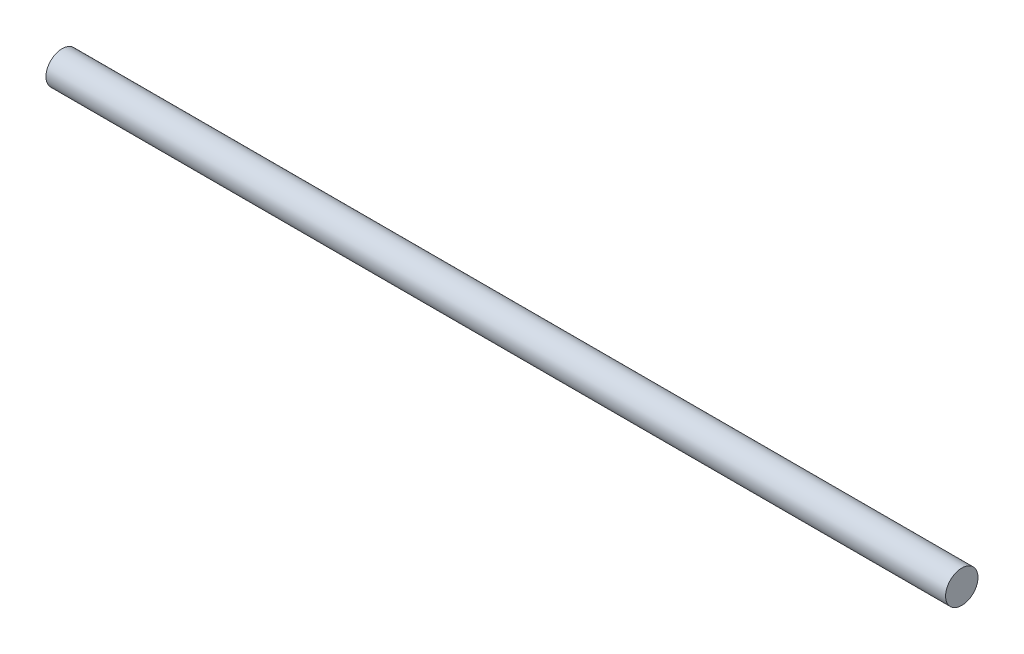
from build123d import *

# Parameters (mm, degrees)
SKETCH1_R           = 4
BOSS_EXTRUDE1_DEPTH = 222


with BuildPart() as part:
    # Sketch1 → Boss-Extrude1 (new body)
    with BuildSketch(Plane(origin=(0, 0, 0), x_dir=(0, 0, -1), z_dir=(1, 0, 0))):
        Circle(SKETCH1_R)
    extrude(amount=BOSS_EXTRUDE1_DEPTH)


solid = part.part
